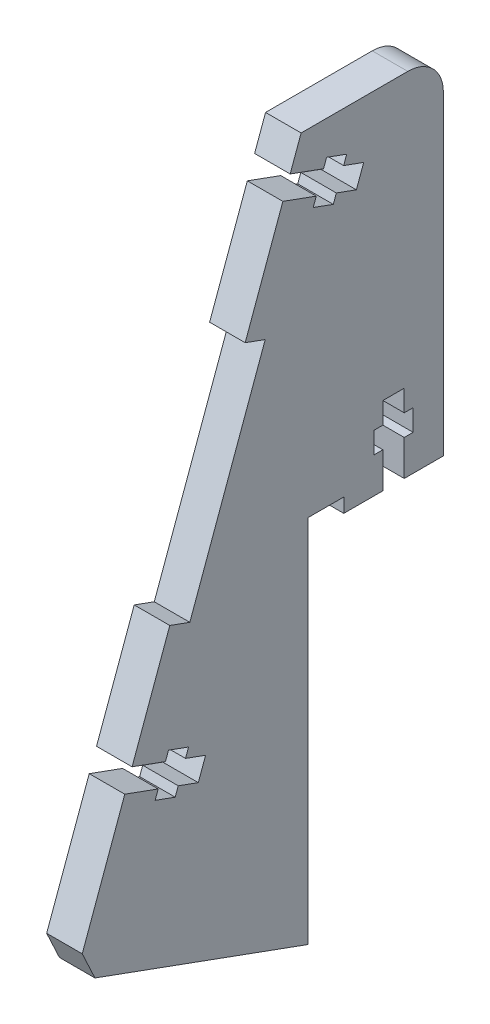
from build123d import *

# Parameters (mm, degrees)
BOSS_EXTRUDE1_DEPTH = 5
CUT_EXTRUDE1_DEPTH  = 73.173788448
CHAMFER1_SIZE       = 3
FILLET1_R           = 5


with BuildPart() as part:
    # Sketch1 → Boss-Extrude1 (new body)
    with BuildSketch(Plane(origin=(0, 0, 0), x_dir=(0, 0, -1), z_dir=(1, 0, 0))):
        Polygon((0, 0), (-14, 0), (-14, 2), (-19, 2), (-19, -50), (-51.807873329, -38.058910659), (-20, 49.332503075), (0, 49.332503075), align=None)
    extrude(amount=BOSS_EXTRUDE1_DEPTH)

    # Sketch2 → Cut-Extrude1 (cut, through all)
    with BuildSketch(Plane(origin=(5, 0, 0), x_dir=(0, 0, -1), z_dir=(1, 0, 0))):
        Polygon((-21.539090645, 45.103886281), (-16.840627541, 43.393785564), (-16.413102362, 44.56840134), (-13.5940245, 43.54234091), (-14.021549679, 42.367725134), (-11.202471816, 41.341664704), (-12.228532246, 38.522586842), (-15.047610109, 39.548647272), (-15.475135288, 38.374031496), (-18.29421315, 39.400091926), (-17.866687971, 40.574707702), (-22.565151075, 42.284808419), align=None)
        Polygon((-43.770399961, -15.97613407), (-44.796460391, -18.795211932), (-40.097997287, -20.505312649), (-40.525522466, -21.679928425), (-37.706444604, -22.705988855), (-37.278919425, -21.531373079), (-34.459841562, -22.557433509), (-33.433781132, -19.738355647), (-36.252858995, -18.712295217), (-35.825333816, -17.537679441), (-38.644411678, -16.511619011), (-39.071936857, -17.686234787), align=None)
        Polygon((-27.866463296, 27.719572796), (-38.46908774, -1.410898448), (-35.650009877, -2.436958878), (-25.047385434, 26.693512366), align=None)
        Polygon((-8.5, 0), (-8.5, 5), (-9.75, 5), (-9.75, 8), (-8.5, 8), (-8.5, 11), (-5.5, 11), (-5.5, 8), (-4.25, 8), (-4.25, 5), (-5.5, 5), (-5.5, 0), align=None)
    extrude(amount=-CUT_EXTRUDE1_DEPTH, mode=Mode.SUBTRACT)

    # Chamfer1
    chamfer1_edges = [part.edges().sort_by_distance(p)[0] for p in [
        (2.5, -38.058910659, 51.807873329),
    ]]
    chamfer(chamfer1_edges, length=CHAMFER1_SIZE)

    # Fillet1
    fillet1_edges = [part.edges().sort_by_distance(p)[0] for p in [
        (2.5, 49.332503075, 0),
    ]]
    fillet(fillet1_edges, radius=FILLET1_R)


solid = part.part
